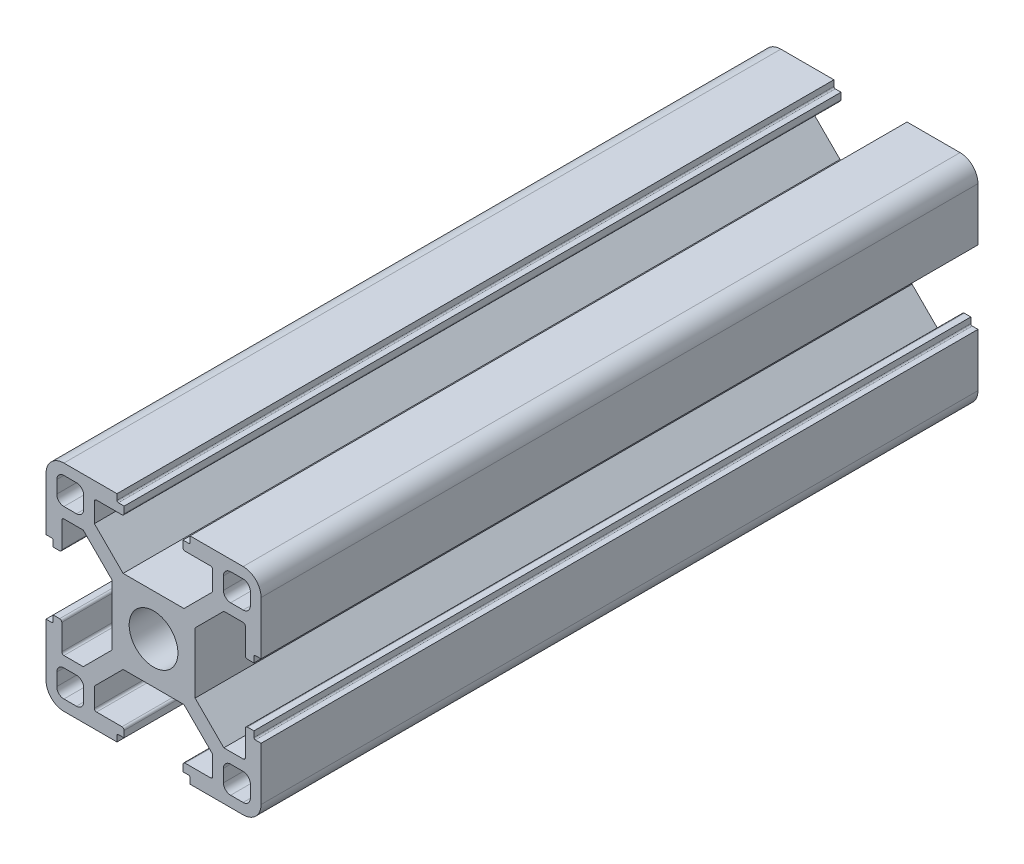
from build123d import *

# Parameters (mm, degrees)
SKETCH_1_R      = 3.4
EXTRUDE_1_DEPTH = 100


with BuildPart() as part:
    # 草图1 → 凸台-拉伸1 (new body)
    with BuildSketch(Plane.XY):
        with BuildLine():
            Line((8.957955872, -8.080050324), (12.963590791, -4.074415406))
            Line((12.963590791, -4.074415406), (15.657955872, -4.074415406))
            ThreePointArc((15.657955872, -4.074415406), (15.870087906, -4.162283371), (15.957955872, -4.374415406))
            Line((15.957955872, -4.374415406), (15.957955872, -7.924415406))
            ThreePointArc((15.957955872, -7.924415406), (16.045823838, -8.13654744), (16.257955872, -8.224415406))
            Line((16.257955872, -8.224415406), (17.157955872, -8.224415406))
            Line((17.157955872, -8.224415406), (17.157955872, -7.424415406))
            ThreePointArc((17.157955872, -7.424415406), (17.216534516, -7.28299405), (17.357955872, -7.224415406))
            Line((17.357955872, -7.224415406), (18.157955872, -7.224415406))
            Line((18.157955872, -7.224415406), (18.157955872, 0.175584594))
            ThreePointArc((18.157955872, 0.175584594), (17.425722825, 1.943351547), (15.657955872, 2.675584594))
            Line((15.657955872, 2.675584594), (8.257955872, 2.675584594))
            Line((8.257955872, 2.675584594), (8.257955872, 1.875584594))
            ThreePointArc((8.257955872, 1.875584594), (8.199377228, 1.734163238), (8.057955872, 1.675584594))
            Line((8.057955872, 1.675584594), (7.257955872, 1.675584594))
            Line((7.257955872, 1.675584594), (7.257955872, 0.775584594))
            ThreePointArc((7.257955872, 0.775584594), (7.345823838, 0.56345256), (7.557955872, 0.475584594))
            Line((7.557955872, 0.475584594), (11.107955872, 0.475584594))
            ThreePointArc((11.107955872, 0.475584594), (11.320087906, 0.387716629), (11.407955872, 0.175584594))
            Line((11.407955872, 0.175584594), (11.407955872, -2.518780487))
            Line((11.407955872, -2.518780487), (7.402320953, -6.524415406))
            Line((7.402320953, -6.524415406), (-1.086409209, -6.524415406))
            Line((-1.086409209, -6.524415406), (-5.092044128, -2.518780487))
            Line((-5.092044128, -2.518780487), (-5.092044128, 0.175584594))
            ThreePointArc((-5.092044128, 0.175584594), (-5.004176162, 0.387716629), (-4.792044128, 0.475584594))
            Line((-4.792044128, 0.475584594), (-1.242044128, 0.475584594))
            ThreePointArc((-1.242044128, 0.475584594), (-1.029912094, 0.56345256), (-0.942044128, 0.775584594))
            Line((-0.942044128, 0.775584594), (-0.942044128, 1.675584594))
            Line((-0.942044128, 1.675584594), (-1.742044128, 1.675584594))
            ThreePointArc((-1.742044128, 1.675584594), (-1.883465484, 1.734163238), (-1.942044128, 1.875584594))
            Line((-1.942044128, 1.875584594), (-1.942044128, 2.675584594))
            Line((-1.942044128, 2.675584594), (-9.342044128, 2.675584594))
            ThreePointArc((-9.342044128, 2.675584594), (-11.109811081, 1.943351547), (-11.842044128, 0.175584594))
            Line((-11.842044128, 0.175584594), (-11.842044128, -7.224415406))
            Line((-11.842044128, -7.224415406), (-11.042044128, -7.224415406))
            ThreePointArc((-11.042044128, -7.224415406), (-10.900622772, -7.28299405), (-10.842044128, -7.424415406))
            Line((-10.842044128, -7.424415406), (-10.842044128, -8.224415406))
            Line((-10.842044128, -8.224415406), (-9.942044128, -8.224415406))
            ThreePointArc((-9.942044128, -8.224415406), (-9.729912094, -8.13654744), (-9.642044128, -7.924415406))
            Line((-9.642044128, -7.924415406), (-9.642044128, -4.374415406))
            ThreePointArc((-9.642044128, -4.374415406), (-9.554176162, -4.162283371), (-9.342044128, -4.074415406))
            Line((-9.342044128, -4.074415406), (-6.647679047, -4.074415406))
            Line((-6.647679047, -4.074415406), (-2.642044128, -8.080050324))
            Line((-2.642044128, -8.080050324), (-2.642044128, -16.568780487))
            Line((-2.642044128, -16.568780487), (-6.647679047, -20.574415406))
            Line((-6.647679047, -20.574415406), (-9.342044128, -20.574415406))
            ThreePointArc((-9.342044128, -20.574415406), (-9.554176162, -20.48654744), (-9.642044128, -20.274415406))
            Line((-9.642044128, -20.274415406), (-9.642044128, -16.724415406))
            ThreePointArc((-9.642044128, -16.724415406), (-9.729912094, -16.512283371), (-9.942044128, -16.424415406))
            Line((-9.942044128, -16.424415406), (-10.842044128, -16.424415406))
            Line((-10.842044128, -16.424415406), (-10.842044128, -17.224415406))
            ThreePointArc((-10.842044128, -17.224415406), (-10.900622772, -17.365836762), (-11.042044128, -17.424415406))
            Line((-11.042044128, -17.424415406), (-11.842044128, -17.424415406))
            Line((-11.842044128, -17.424415406), (-11.842044128, -24.824415406))
            ThreePointArc((-11.842044128, -24.824415406), (-11.109811081, -26.592182359), (-9.342044128, -27.324415406))
            Line((-9.342044128, -27.324415406), (-1.942044128, -27.324415406))
            Line((-1.942044128, -27.324415406), (-1.942044128, -26.524415406))
            ThreePointArc((-1.942044128, -26.524415406), (-1.883465484, -26.38299405), (-1.742044128, -26.324415406))
            Line((-1.742044128, -26.324415406), (-0.942044128, -26.324415406))
            Line((-0.942044128, -26.324415406), (-0.942044128, -25.424415406))
            ThreePointArc((-0.942044128, -25.424415406), (-1.029912094, -25.212283371), (-1.242044128, -25.124415406))
            Line((-1.242044128, -25.124415406), (-4.792044128, -25.124415406))
            ThreePointArc((-4.792044128, -25.124415406), (-5.004176162, -25.03654744), (-5.092044128, -24.824415406))
            Line((-5.092044128, -24.824415406), (-5.092044128, -22.130050324))
            Line((-5.092044128, -22.130050324), (-1.086409209, -18.124415406))
            Line((-1.086409209, -18.124415406), (7.402320953, -18.124415406))
            Line((7.402320953, -18.124415406), (11.407955872, -22.130050324))
            Line((11.407955872, -22.130050324), (11.407955872, -24.824415406))
            ThreePointArc((11.407955872, -24.824415406), (11.320087906, -25.03654744), (11.107955872, -25.124415406))
            Line((11.107955872, -25.124415406), (7.557955872, -25.124415406))
            ThreePointArc((7.557955872, -25.124415406), (7.345823838, -25.212283371), (7.257955872, -25.424415406))
            Line((7.257955872, -25.424415406), (7.257955872, -26.324415406))
            Line((7.257955872, -26.324415406), (8.057955872, -26.324415406))
            ThreePointArc((8.057955872, -26.324415406), (8.199377228, -26.38299405), (8.257955872, -26.524415406))
            Line((8.257955872, -26.524415406), (8.257955872, -27.324415406))
            Line((8.257955872, -27.324415406), (15.657955872, -27.324415406))
            ThreePointArc((15.657955872, -27.324415406), (17.425722825, -26.592182359), (18.157955872, -24.824415406))
            Line((18.157955872, -24.824415406), (18.157955872, -17.424415406))
            Line((18.157955872, -17.424415406), (17.357955872, -17.424415406))
            ThreePointArc((17.357955872, -17.424415406), (17.216534516, -17.365836762), (17.157955872, -17.224415406))
            Line((17.157955872, -17.224415406), (17.157955872, -16.424415406))
            Line((17.157955872, -16.424415406), (16.257955872, -16.424415406))
            ThreePointArc((16.257955872, -16.424415406), (16.045823838, -16.512283371), (15.957955872, -16.724415406))
            Line((15.957955872, -16.724415406), (15.957955872, -20.274415406))
            ThreePointArc((15.957955872, -20.274415406), (15.870087906, -20.48654744), (15.657955872, -20.574415406))
            Line((15.657955872, -20.574415406), (12.963590791, -20.574415406))
            Line((12.963590791, -20.574415406), (8.957955872, -16.568780487))
            Line((8.957955872, -16.568780487), (8.957955872, -8.080050324))
        make_face()
        with Locations((3.157955872, -12.324415406)):
            Circle(SKETCH_1_R, mode=Mode.SUBTRACT)
        with BuildLine():
            Line((13.907955872, -22.074415406), (15.657955872, -22.074415406))
            ThreePointArc((15.657955872, -22.074415406), (16.365062653, -22.367308625), (16.657955872, -23.074415406))
            Line((16.657955872, -23.074415406), (16.657955872, -24.824415406))
            ThreePointArc((16.657955872, -24.824415406), (16.365062653, -25.531522187), (15.657955872, -25.824415406))
            Line((15.657955872, -25.824415406), (13.907955872, -25.824415406))
            ThreePointArc((13.907955872, -25.824415406), (13.200849091, -25.531522187), (12.907955872, -24.824415406))
            Line((12.907955872, -24.824415406), (12.907955872, -23.074415406))
            ThreePointArc((12.907955872, -23.074415406), (13.200849091, -22.367308625), (13.907955872, -22.074415406))
        make_face(mode=Mode.SUBTRACT)
        with BuildLine():
            Line((12.907955872, -1.574415406), (12.907955872, 0.175584594))
            ThreePointArc((12.907955872, 0.175584594), (13.200849091, 0.882691375), (13.907955872, 1.175584594))
            Line((13.907955872, 1.175584594), (15.657955872, 1.175584594))
            ThreePointArc((15.657955872, 1.175584594), (16.365062653, 0.882691375), (16.657955872, 0.175584594))
            Line((16.657955872, 0.175584594), (16.657955872, -1.574415406))
            ThreePointArc((16.657955872, -1.574415406), (16.365062653, -2.281522187), (15.657955872, -2.574415406))
            Line((15.657955872, -2.574415406), (13.907955872, -2.574415406))
            ThreePointArc((13.907955872, -2.574415406), (13.200849091, -2.281522187), (12.907955872, -1.574415406))
        make_face(mode=Mode.SUBTRACT)
        with BuildLine():
            Line((-6.592044128, -23.074415406), (-6.592044128, -24.824415406))
            ThreePointArc((-6.592044128, -24.824415406), (-6.884937347, -25.531522187), (-7.592044128, -25.824415406))
            Line((-7.592044128, -25.824415406), (-9.342044128, -25.824415406))
            ThreePointArc((-9.342044128, -25.824415406), (-10.049150909, -25.531522187), (-10.342044128, -24.824415406))
            Line((-10.342044128, -24.824415406), (-10.342044128, -23.074415406))
            ThreePointArc((-10.342044128, -23.074415406), (-10.049150909, -22.367308625), (-9.342044128, -22.074415406))
            Line((-9.342044128, -22.074415406), (-7.592044128, -22.074415406))
            ThreePointArc((-7.592044128, -22.074415406), (-6.884937347, -22.367308625), (-6.592044128, -23.074415406))
        make_face(mode=Mode.SUBTRACT)
        with BuildLine():
            Line((-7.592044128, -2.574415406), (-9.342044128, -2.574415406))
            ThreePointArc((-9.342044128, -2.574415406), (-10.049150909, -2.281522187), (-10.342044128, -1.574415406))
            Line((-10.342044128, -1.574415406), (-10.342044128, 0.175584594))
            ThreePointArc((-10.342044128, 0.175584594), (-10.049150909, 0.882691375), (-9.342044128, 1.175584594))
            Line((-9.342044128, 1.175584594), (-7.592044128, 1.175584594))
            ThreePointArc((-7.592044128, 1.175584594), (-6.884937347, 0.882691375), (-6.592044128, 0.175584594))
            Line((-6.592044128, 0.175584594), (-6.592044128, -1.574415406))
            ThreePointArc((-6.592044128, -1.574415406), (-6.884937347, -2.281522187), (-7.592044128, -2.574415406))
        make_face(mode=Mode.SUBTRACT)
    extrude(amount=EXTRUDE_1_DEPTH)


solid = part.part
